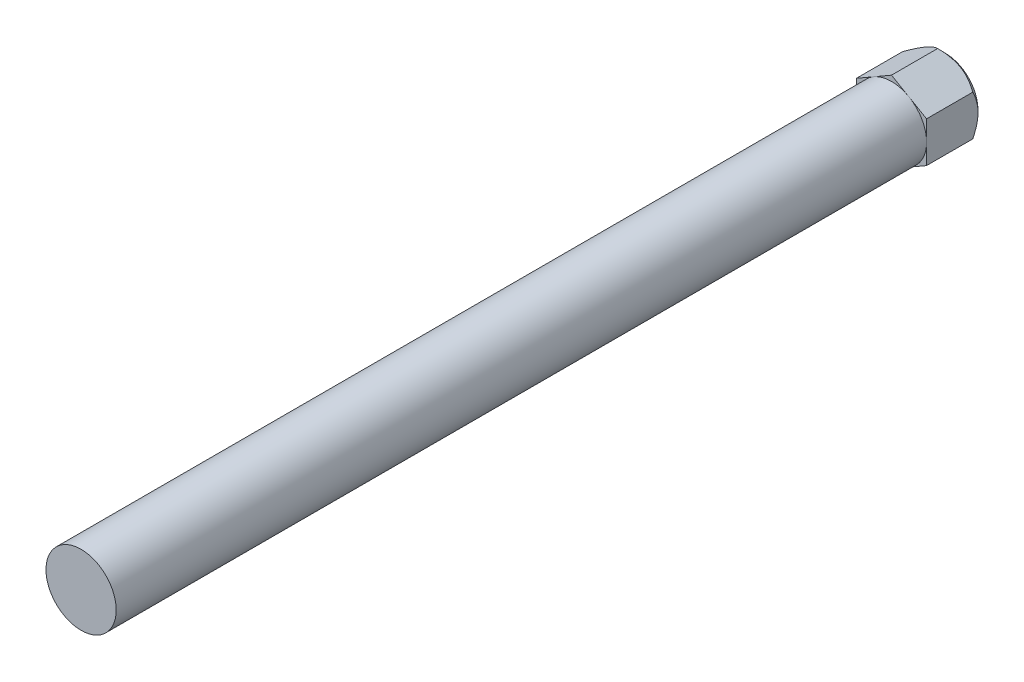
from build123d import *

# Parameters (mm, degrees)
BOSS_EXTRUDE1_DEPTH = 0.2
SKETCH5_R           = 0.13
BOSS_EXTRUDE2_DEPTH = 3


with BuildPart() as part:
    # Sketch1 → Boss-Extrude1 (new body)
    with BuildSketch(Plane.XY):
        Polygon((0, 0.15), (-0.129903811, 0.075), (-0.129903811, -0.075), (0, -0.15), (0.129903811, -0.075), (0.129903811, 0.075), align=None)
    extrude(amount=BOSS_EXTRUDE1_DEPTH)

    # Sketch5 → Boss-Extrude2 (add)
    with BuildSketch(Plane.XY.offset(0.2)):
        with Locations(Location((0, 0, 0), (0, 0, 177.795772496))):
            Circle(SKETCH5_R)
    extrude(amount=BOSS_EXTRUDE2_DEPTH)

    # Sketch3 → Cut-Revolve2 (revolve, cut)
    with BuildSketch(Plane(origin=(0, 0, 0), x_dir=(0, 0, -1), z_dir=(1, 0, 0)), mode=Mode.PRIVATE) as cut_revolve2_sk:
        Polygon((-0.028916319, 0.15), (0, 0.15), (0, 0.12), align=None)
    revolve(cut_revolve2_sk.sketch.rotate(Axis((0, 0, 0.2), (0, 0, -1)), 180), axis=Axis((0, 0, 0.2), (0, 0, -1)), mode=Mode.SUBTRACT)


solid = part.part
